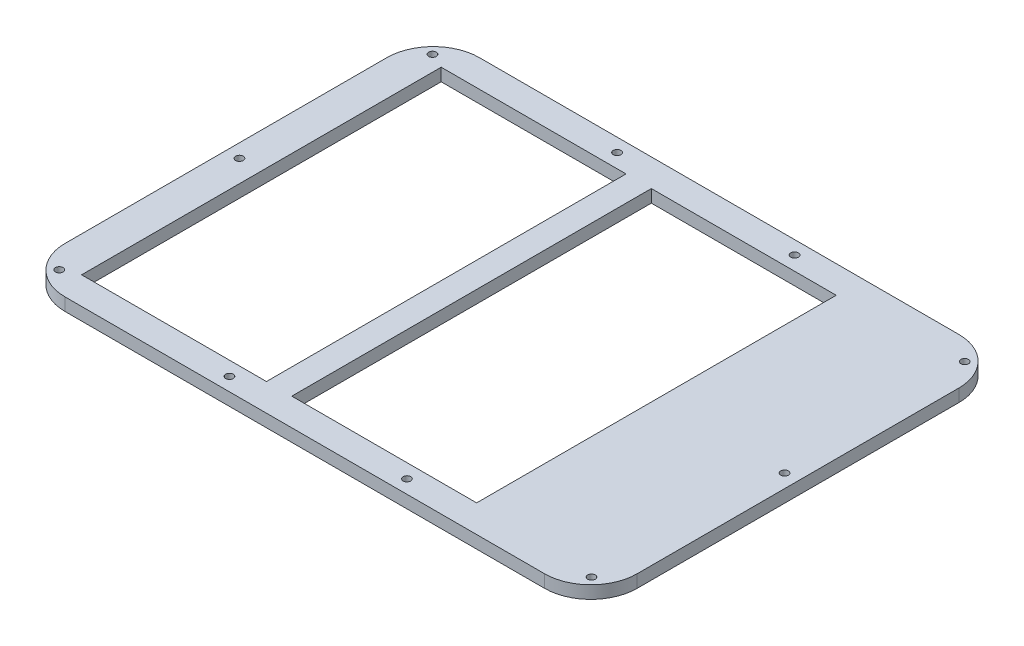
from build123d import *

# Parameters (mm, degrees)
ESQUISSE1_W        = 225.94062
ESQUISSE1_H        = 163.6522
ESQUISSE1_R        = 1.5
ESQUISSE1_W_2      = 73
ESQUISSE1_H_2      = 142
BOSS_EXTRU_1_DEPTH = 5
CONG_2_R           = 18.3


with BuildPart() as part:
    # Esquisse1 → Boss.-Extru.1 (new body)
    with BuildSketch(Plane(origin=(0, 0, 0), x_dir=(1, 0, 0), z_dir=(0, 1, 0))):
        Rectangle(ESQUISSE1_W, ESQUISSE1_H)
        with Locations(Location((-105.09631, 73.6981, 0), (0, 0, 270))):
            Circle(ESQUISSE1_R, mode=Mode.SUBTRACT)
        with Locations(Location((-35.04311, 76.5429, 0), (0, 0, 270))):
            Circle(ESQUISSE1_R, mode=Mode.SUBTRACT)
        with Locations(Location((-107.63631, 0, 0), (0, 0, 270))):
            Circle(ESQUISSE1_R, mode=Mode.SUBTRACT)
        with Locations(Location((107.63631, 0, 0), (0, 0, 90))):
            Circle(ESQUISSE1_R, mode=Mode.SUBTRACT)
        with Locations(Location((35.04311, 76.5429, 0), (0, 0, 90))):
            Circle(ESQUISSE1_R, mode=Mode.SUBTRACT)
        with Locations(Location((105.09631, 73.6981, 0), (0, 0, 90))):
            Circle(ESQUISSE1_R, mode=Mode.SUBTRACT)
        with Locations(Location((105.09631, -73.6981, 0), (0, 0, 270))):
            Circle(ESQUISSE1_R, mode=Mode.SUBTRACT)
        with Locations(Location((35.04311, -76.5429, 0), (0, 0, 270))):
            Circle(ESQUISSE1_R, mode=Mode.SUBTRACT)
        with Locations(Location((-35.04311, -76.5429, 0), (0, 0, 90))):
            Circle(ESQUISSE1_R, mode=Mode.SUBTRACT)
        with Locations(Location((-105.09631, -73.6981, 0), (0, 0, 90))):
            Circle(ESQUISSE1_R, mode=Mode.SUBTRACT)
        with Locations((-62.47031, 0)):
            Rectangle(ESQUISSE1_W_2, ESQUISSE1_H_2, mode=Mode.SUBTRACT)
        with Locations((20.52969, 0)):
            Rectangle(ESQUISSE1_W_2, ESQUISSE1_H_2, mode=Mode.SUBTRACT)
    extrude(amount=BOSS_EXTRU_1_DEPTH)

    # Congé2
    cong_2_edges = [part.edges().sort_by_distance(p)[0] for p in [
        (-112.97031, 2.5, -81.8261),
        (112.97031, 2.5, -81.8261),
        (112.97031, 2.5, 81.8261),
        (-112.97031, 2.5, 81.8261),
    ]]
    fillet(cong_2_edges, radius=CONG_2_R)


solid = part.part
